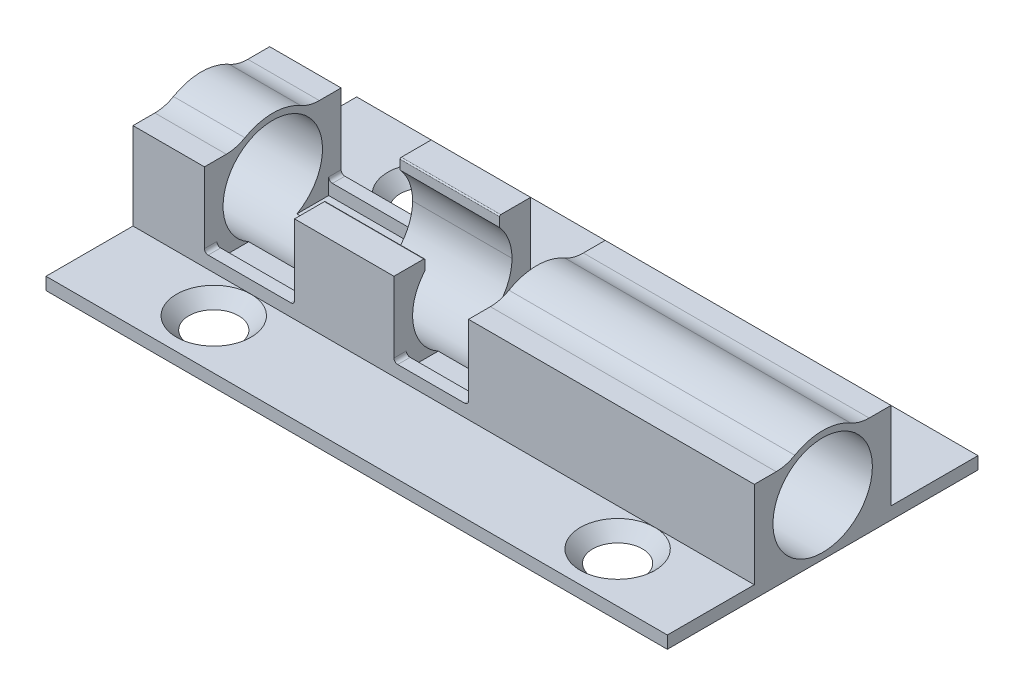
from build123d import *

# Parameters (mm, degrees)
SKETCH1_W                                      = 50
SKETCH1_H                                      = 25
BOSS_EXTRUDE1_DEPTH                            = 1
SKETCH4_W                                      = 50
SKETCH4_H                                      = 11
BOSS_EXTRUDE2_DEPTH                            = 7
SKETCH11_R                                     = 4.5
BOSS_EXTRUDE5_DEPTH                            = 50
SKETCH12_R                                     = 4
CUT_EXTRUDE2_DEPTH                             = 57.621550668
FILLET1_R                                      = 3
SKETCH17_W                                     = 6
SKETCH17_H                                     = 11
CUT_EXTRUDE4_DEPTH                             = 41
SKETCH23_W                                     = 6
SKETCH23_H                                     = 11
CUT_EXTRUDE5_DEPTH                             = 10
SKETCH24_W                                     = 8
SKETCH24_H                                     = 11
CUT_EXTRUDE6_DEPTH                             = 8
SKETCH25_W                                     = 8
SKETCH25_H                                     = 6
CUT_EXTRUDE7_DEPTH                             = 2
FILLET4_R                                      = 0.1
CSK_FOR_M3_OVAL_HEAD_MACHINE_SCREW1_AT_2_COUNT = 2
CSK_FOR_M3_OVAL_HEAD_MACHINE_SCREW1_AT_2_PITCH = 32.5
CSK_FOR_M3_OVAL_HEAD_MACHINE_SCREW1_AT_3_COUNT = 2
CSK_FOR_M3_OVAL_HEAD_MACHINE_SCREW1_AT_3_PITCH = 36.67764987
CSK_FOR_M3_OVAL_HEAD_MACHINE_SCREW1_AT_4_COUNT = 2
CSK_FOR_M3_OVAL_HEAD_MACHINE_SCREW1_AT_4_PITCH = 17
SKETCH29_W                                     = 6
SKETCH29_H                                     = 1
BOSS_EXTRUDE9_DEPTH                            = 1
SKETCH30_W                                     = 6
SKETCH30_H                                     = 1
BOSS_EXTRUDE10_DEPTH                           = 1
SKETCH32_W                                     = 6
SKETCH32_H                                     = 1
BOSS_EXTRUDE11_DEPTH                           = 1
SKETCH33_W                                     = 6
SKETCH33_H                                     = 1
BOSS_EXTRUDE12_DEPTH                           = 1
SKETCH37_W                                     = 9
SKETCH37_H                                     = 16
CUT_EXTRUDE10_DEPTH                            = 1.25
SKETCH41_W                                     = 1
SKETCH41_H                                     = 6
CUT_EXTRUDE12_DEPTH                            = 1.25
SKETCH42_W                                     = 1
SKETCH42_H                                     = 6
CUT_EXTRUDE13_DEPTH                            = 1.25
FILLET5_R                                      = 0.3


with BuildPart() as part:
    # Sketch1 → Boss-Extrude1 (new body)
    with BuildSketch(Plane(origin=(0, 0, 0), x_dir=(1, 0, 0), z_dir=(0, 1, 0))):
        with Locations((25, 12.5)):
            Rectangle(SKETCH1_W, SKETCH1_H)
    extrude(amount=BOSS_EXTRUDE1_DEPTH)

    # Sketch4 → Boss-Extrude2 (add)
    with BuildSketch(Plane(origin=(0, 1, 0), x_dir=(1, 0, 0), z_dir=(0, 1, 0))):
        with Locations((25, 12.5)):
            Rectangle(SKETCH4_W, SKETCH4_H)
    extrude(amount=BOSS_EXTRUDE2_DEPTH)

    # Sketch11 → Boss-Extrude5 (add, through all)
    with BuildSketch(Plane(origin=(50, 0, 0), x_dir=(0, 0, -1), z_dir=(1, 0, 0))):
        with Locations((12.5, 4.5)):
            Circle(SKETCH11_R)
    extrude(amount=-BOSS_EXTRUDE5_DEPTH)

    # Sketch12 → Cut-Extrude2 (cut, through all)
    with BuildSketch(Plane(origin=(50, 0, 0), x_dir=(0, 0, -1), z_dir=(1, 0, 0))):
        with Locations((12.5, 4.5)):
            Circle(SKETCH12_R)
    extrude(amount=-CUT_EXTRUDE2_DEPTH, mode=Mode.SUBTRACT)

    # Fillet1
    fillet1_edges = [part.edges().sort_by_distance(p)[0] for p in [
        (25, 8, -15.328427125),
        (25, 8, -9.671572875),
    ]]
    fillet(fillet1_edges, radius=FILLET1_R)

    # Sketch17 → Cut-Extrude4 (cut)
    with BuildSketch(Plane(origin=(0, 1, 0), x_dir=(1, 0, 0), z_dir=(0, 1, 0))):
        with Locations((24, 12.5)):
            Rectangle(SKETCH17_W, SKETCH17_H)
    extrude(amount=CUT_EXTRUDE4_DEPTH, mode=Mode.SUBTRACT)

    # Sketch23 → Cut-Extrude5 (cut)
    with BuildSketch(Plane(origin=(0, 1, 0), x_dir=(1, 0, 0), z_dir=(0, 1, 0))):
        with Locations((10, 12.5)):
            Rectangle(SKETCH23_W, SKETCH23_H)
    extrude(amount=CUT_EXTRUDE5_DEPTH, mode=Mode.SUBTRACT)

    # Sketch24 → Cut-Extrude6 (cut)
    with BuildSketch(Plane(origin=(0, 8, 0), x_dir=(1, 0, 0), z_dir=(0, 1, 0))):
        with Locations((17, 12.5)):
            Rectangle(SKETCH24_W, SKETCH24_H)
    extrude(amount=CUT_EXTRUDE6_DEPTH, mode=Mode.SUBTRACT)

    # Sketch25 → Cut-Extrude7 (cut)
    with BuildSketch(Plane(origin=(0, 8, 0), x_dir=(1, 0, 0), z_dir=(0, 1, 0))):
        with Locations((17, 12.496548068)):
            Rectangle(SKETCH25_W, SKETCH25_H)
    extrude(amount=-CUT_EXTRUDE7_DEPTH, mode=Mode.SUBTRACT)

    # Fillet4
    fillet4_edges = [part.edges().sort_by_distance(p)[0] for p in [
        (17, 8, -9.496548068),
        (17, 8, -15.496548068),
    ]]
    fillet(fillet4_edges, radius=FILLET4_R)

    # Sketch27 → CSK for M3 Oval Head Machine Screw1 (revolve, cut)
    with BuildSketch(Plane(origin=(9.5, 1, -4), x_dir=(0, 0, 1), z_dir=(1, 0, 0))):
        Polygon((0, 0), (0, 1), (1.5, 1), (1.5, 1.5), (3, 0), align=None)
    csk_for_m3_oval_head_machine_screw1 = revolve(axis=Axis((9.5, 7.35, -4), (0, -1, 0)), mode=Mode.SUBTRACT)

    # CSK for M3 Oval Head Machine Screw1 at 2: CSK for M3 Oval Head Machine Screw1 ×2
    with Locations(*[(i * CSK_FOR_M3_OVAL_HEAD_MACHINE_SCREW1_AT_2_PITCH, 0, 0) for i in range(1, CSK_FOR_M3_OVAL_HEAD_MACHINE_SCREW1_AT_2_COUNT)]):
        add(csk_for_m3_oval_head_machine_screw1, mode=Mode.SUBTRACT)

    # CSK for M3 Oval Head Machine Screw1 at 3: CSK for M3 Oval Head Machine Screw1 ×2
    with Locations(*[Vector(0.88609821280882, 0, -0.463497526699998) * (i * CSK_FOR_M3_OVAL_HEAD_MACHINE_SCREW1_AT_3_PITCH) for i in range(1, CSK_FOR_M3_OVAL_HEAD_MACHINE_SCREW1_AT_3_COUNT)]):
        add(csk_for_m3_oval_head_machine_screw1, mode=Mode.SUBTRACT)

    # CSK for M3 Oval Head Machine Screw1 at 4: CSK for M3 Oval Head Machine Screw1 ×2
    with Locations(*[(0, 0, -i * CSK_FOR_M3_OVAL_HEAD_MACHINE_SCREW1_AT_4_PITCH) for i in range(1, CSK_FOR_M3_OVAL_HEAD_MACHINE_SCREW1_AT_4_COUNT)]):
        add(csk_for_m3_oval_head_machine_screw1, mode=Mode.SUBTRACT)

    # Sketch29 → Boss-Extrude9 (add)
    with BuildSketch(Plane(origin=(0, 1, 0), x_dir=(1, 0, 0), z_dir=(0, 1, 0))):
        with Locations((10, 7.5)):
            Rectangle(SKETCH29_W, SKETCH29_H)
    extrude(amount=BOSS_EXTRUDE9_DEPTH)

    # Sketch30 → Boss-Extrude10 (add)
    with BuildSketch(Plane(origin=(0, 1, 0), x_dir=(1, 0, 0), z_dir=(0, 1, 0))):
        with Locations((24, 7.5)):
            Rectangle(SKETCH30_W, SKETCH30_H)
    extrude(amount=BOSS_EXTRUDE10_DEPTH)

    # Sketch32 → Boss-Extrude11 (add)
    with BuildSketch(Plane(origin=(0, 1, 0), x_dir=(1, 0, 0), z_dir=(0, 1, 0))):
        with Locations((10, 17.5)):
            Rectangle(SKETCH32_W, SKETCH32_H)
    extrude(amount=BOSS_EXTRUDE11_DEPTH)

    # Sketch33 → Boss-Extrude12 (add)
    with BuildSketch(Plane(origin=(0, 1, 0), x_dir=(1, 0, 0), z_dir=(0, 1, 0))):
        with Locations((24, 17.5)):
            Rectangle(SKETCH33_W, SKETCH33_H)
    extrude(amount=BOSS_EXTRUDE12_DEPTH)

    # Sketch37 → Cut-Extrude10 (cut)
    with BuildSketch(Plane(origin=(7, 0, 0), x_dir=(0, 0, -1), z_dir=(1, 0, 0))):
        with Locations((12.5, 9)):
            Rectangle(SKETCH37_W, SKETCH37_H)
    extrude(amount=-CUT_EXTRUDE10_DEPTH, mode=Mode.SUBTRACT)

    # Sketch41 → Cut-Extrude12 (cut)
    with BuildSketch(Plane(origin=(7, 0, 0), x_dir=(0, 0, -1), z_dir=(1, 0, 0))):
        with Locations((7.5, 5)):
            Rectangle(SKETCH41_W, SKETCH41_H)
    extrude(amount=-CUT_EXTRUDE12_DEPTH, mode=Mode.SUBTRACT)

    # Sketch42 → Cut-Extrude13 (cut)
    with BuildSketch(Plane(origin=(7, 0, 0), x_dir=(0, 0, -1), z_dir=(1, 0, 0))):
        with Locations((17.5, 5)):
            Rectangle(SKETCH42_W, SKETCH42_H)
    extrude(amount=-CUT_EXTRUDE13_DEPTH, mode=Mode.SUBTRACT)

    # Fillet5
    fillet5_edges = [part.edges().sort_by_distance(p)[0] for p in [
        (13, 2, -7.5),
        (21, 2, -7.5),
        (27, 2, -7.5),
        (13, 2, -17.5),
        (21, 2, -17.5),
        (27, 2, -17.5),
        (5.75, 2, -7.5),
        (5.75, 2, -17.5),
    ]]
    fillet(fillet5_edges, radius=FILLET5_R)


solid = part.part
